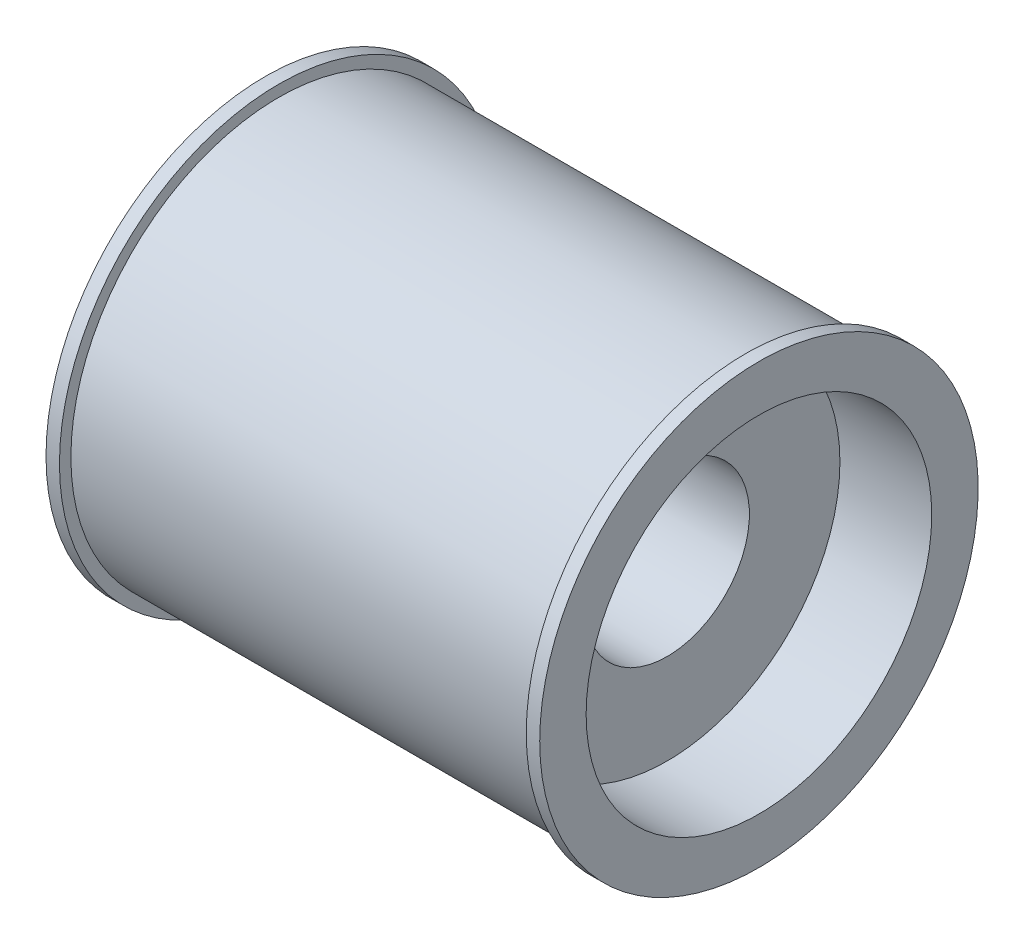
from build123d import *


with BuildPart() as part:
    # Sketch1 → Revolve1 (revolve)
    with BuildSketch(Plane.XY, mode=Mode.PRIVATE) as revolve1_sk:
        Polygon((18.843245601, 21), (30, 21), (30, 26.641606243), (28.365129375, 26.641606243), (28.365129375, 25.251966211), (-28.365129375, 25.251966211), (-28.365129375, 26.641606243), (-30, 26.641606243), (-30, 21), (-18.843245601, 21), (-18.843245601, 10), (18.843245601, 10), align=None)
    revolve(revolve1_sk.sketch.rotate(Axis((0, 0, 0), (1, 0, 0)), 90), axis=Axis((0, 0, 0), (1, 0, 0)))


solid = part.part
